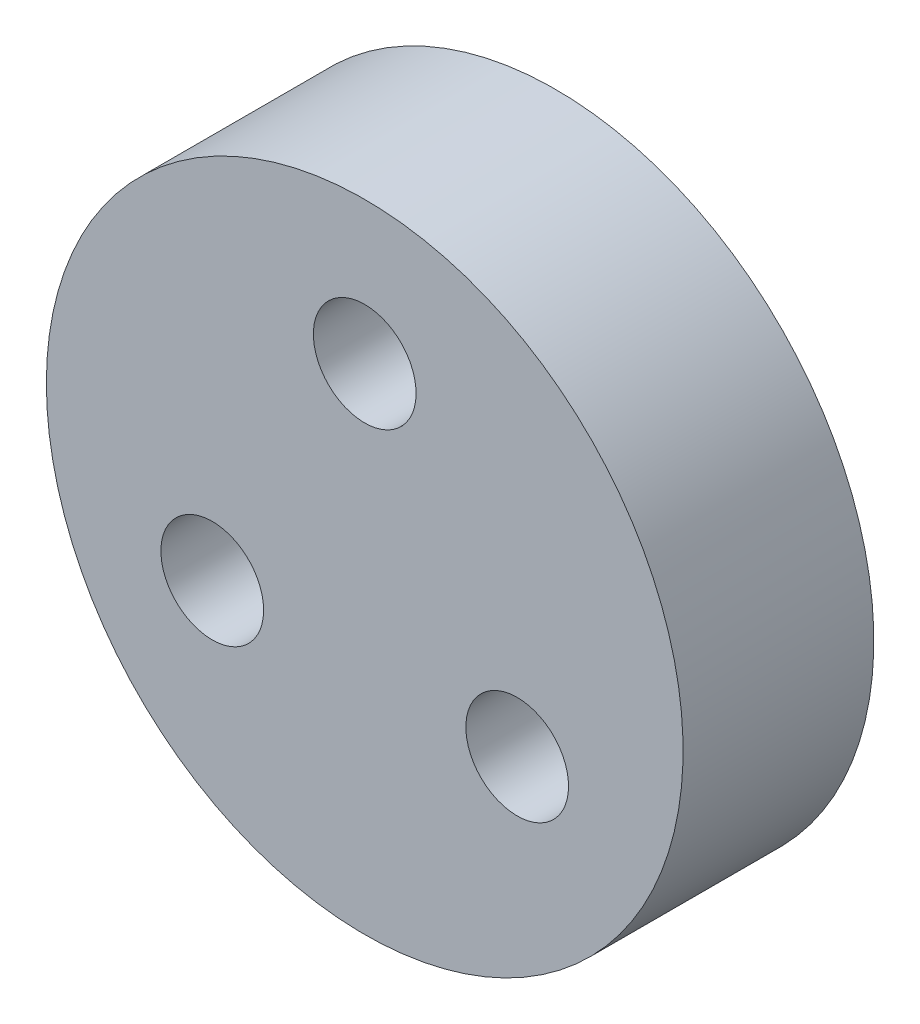
from build123d import *

# Parameters (mm, degrees)
SKETCH1_R           = 10.85
BOSS_EXTRUDE1_DEPTH = 6.5
SKETCH2_R           = 1.75
CUT_EXTRUDE1_DEPTH  = 17.664183148


with BuildPart() as part:
    # Sketch1 → Boss-Extrude1 (new body)
    with BuildSketch(Plane.XY):
        with Locations(Location((0, 0, 0), (0, 0, 180))):
            Circle(SKETCH1_R)
    extrude(amount=BOSS_EXTRUDE1_DEPTH)

    # Sketch2 → Cut-Extrude1 (cut, through all)
    with BuildSketch(Plane.XY.offset(6.5)):
        with Locations((0, 6)):
            Circle(SKETCH2_R)
        with Locations((5.196152423, -3)):
            Circle(SKETCH2_R)
        with Locations((-5.196152423, -3)):
            Circle(SKETCH2_R)
    extrude(amount=-CUT_EXTRUDE1_DEPTH, mode=Mode.SUBTRACT)


solid = part.part
